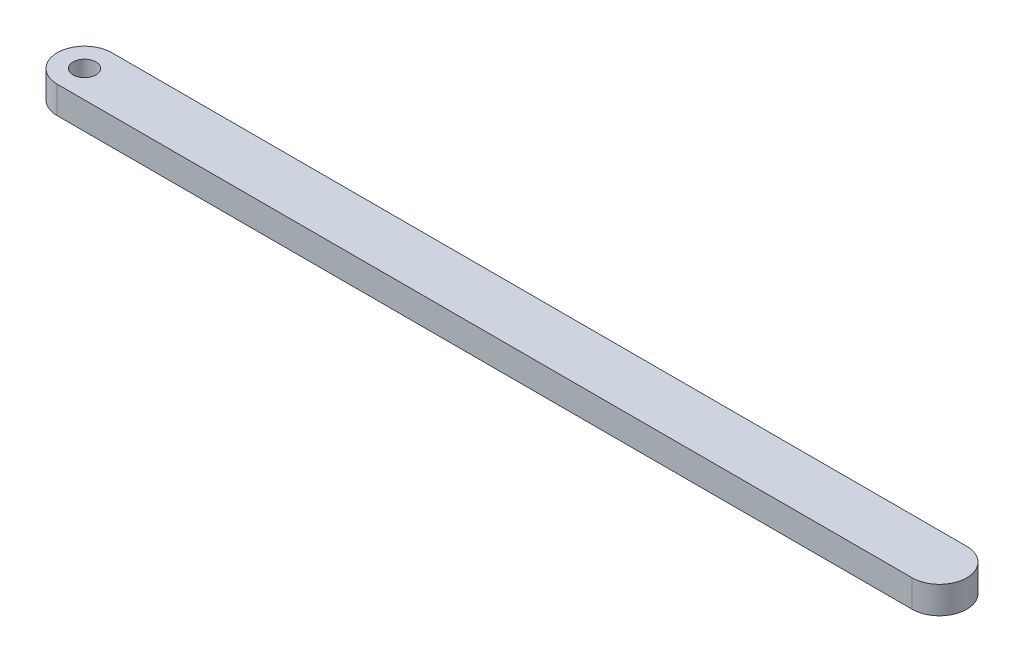
from build123d import *

# Parameters (mm, degrees)
SKETCH1_R           = 2.5
BOSS_EXTRUDE1_DEPTH = 6


with BuildPart() as part:
    # Sketch1 → Boss-Extrude1 (new body)
    with BuildSketch(Plane(origin=(0, 0, 0), x_dir=(1, 0, 0), z_dir=(0, 1, 0))):
        with BuildLine():
            Line((0, 6), (188, 6))
            ThreePointArc((188, 6), (194, 0), (188, -6))
            Line((188, -6), (0, -6))
            ThreePointArc((0, -6), (-6, 0), (0, 6))
        make_face()
        with Locations(Location((0, 0, 0), (0, 0, 270))):
            Circle(SKETCH1_R, mode=Mode.SUBTRACT)
    extrude(amount=BOSS_EXTRUDE1_DEPTH)


solid = part.part
